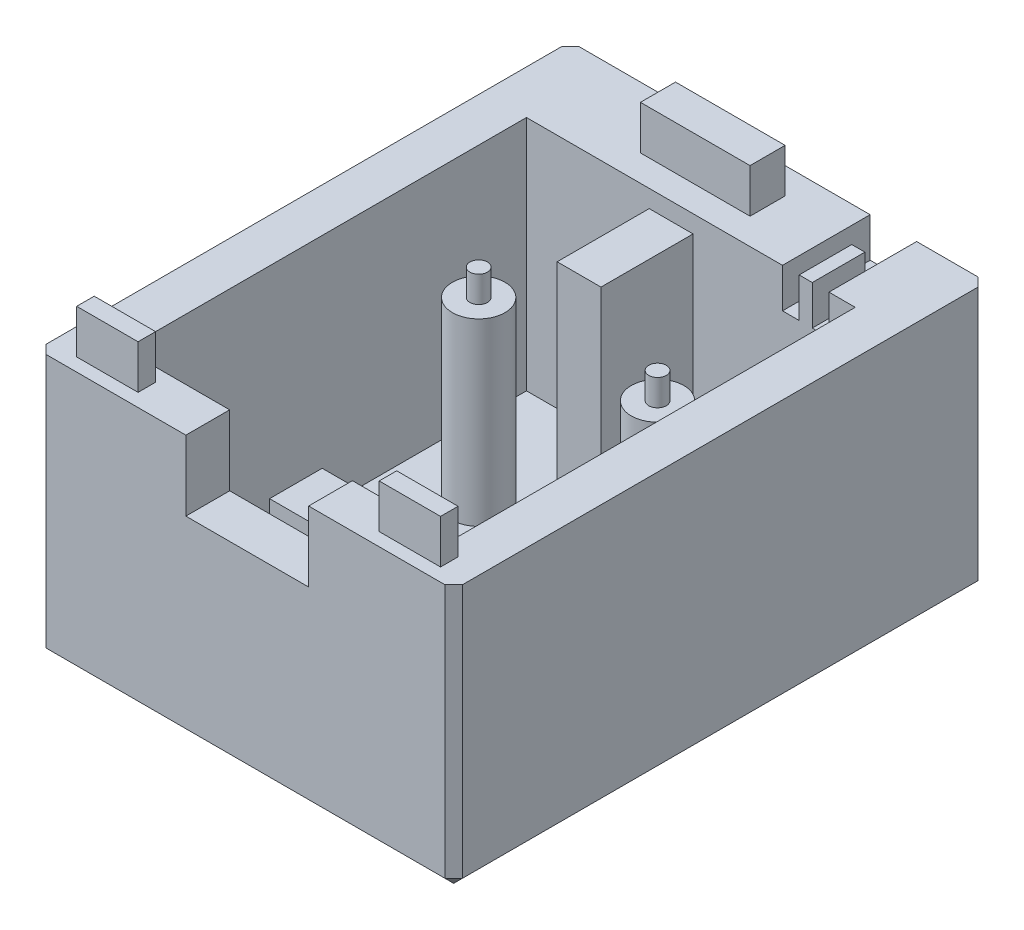
from build123d import *

# Parameters (mm, degrees)
SKETCH_1_W          = 47.5
SKETCH_1_H          = 60.8
EXTRUDE_1_DEPTH     = 30
SKETCH_3_W          = 37.5
SKETCH_3_H          = 45.8
CUT_EXTRUDE_1_DEPTH = 27
SKETCH_4_W          = 14
SKETCH_4_H          = 5
CUT_EXTRUDE_2_DEPTH = 8
SKETCH_5_R          = 3
SKETCH_5_W          = 6
SKETCH_5_H          = 6
EXTRUDE_4_DEPTH     = 20.5
SKETCH_6_W          = 5
SKETCH_6_H          = 10.5
EXTRUDE_6_DEPTH     = 25
SKETCH_7_R          = 1
EXTRUDE_7_DEPTH     = 3
SKETCH_12_W         = 5.3
SKETCH_12_H         = 4.5
CUT_EXTRUDE_5_DEPTH = 10
SKETCH_13_W         = 1.5
SKETCH_13_H         = 6
EXTRUDE_8_DEPTH     = 4.5
SKETCH_14_W         = 30
SKETCH_14_H         = 3
CUT_EXTRUDE_6_DEPTH = 3
CHAMFER_1_SIZE      = 1
SKETCH_16_W         = 12.5
SKETCH_16_H         = 4
SKETCH_16_W_2       = 7
SKETCH_16_H_2       = 2
EXTRUDE_9_DEPTH     = 5


with BuildPart() as part:
    # 草图1 → 凸台-拉伸1 (new body)
    with BuildSketch(Plane(origin=(0, 0, 0), x_dir=(1, 0, 0), z_dir=(0, 1, 0))):
        with Locations((-26.283333333, -1.583333333)):
            Rectangle(SKETCH_1_W, SKETCH_1_H)
    extrude(amount=EXTRUDE_1_DEPTH)

    # 草图3 → 切除-拉伸1 (cut)
    with BuildSketch(Plane(origin=(0, 30, 0), x_dir=(1, 0, 0), z_dir=(0, 1, 0))):
        with Locations((-26.283333333, -4.083333333)):
            Rectangle(SKETCH_3_W, SKETCH_3_H)
    extrude(amount=-CUT_EXTRUDE_1_DEPTH, mode=Mode.SUBTRACT)

    # 草图4 → 切除-拉伸2 (cut)
    with BuildSketch(Plane(origin=(0, 30, 0), x_dir=(1, 0, 0), z_dir=(0, 1, 0))):
        with Locations((-26.083333333, -29.483333333)):
            Rectangle(SKETCH_4_W, SKETCH_4_H)
    extrude(amount=-CUT_EXTRUDE_2_DEPTH, mode=Mode.SUBTRACT)

    # 草图5 → 凸台-拉伸4 (add)
    with BuildSketch(Plane(origin=(0, 3, 0), x_dir=(1, 0, 0), z_dir=(0, 1, 0))):
        with Locations(Location((-16.083333333, 4.816666667, 0), (0, 0, 270))):
            Circle(SKETCH_5_R)
        with Locations(Location((-36.483333333, 4.816666667, 0), (0, 0, 270))):
            Circle(SKETCH_5_R)
        with Locations((-25.533333333, -23.983333333)):
            Rectangle(SKETCH_5_W, SKETCH_5_H)
    extrude(amount=EXTRUDE_4_DEPTH)

    # 草图6 → 凸台-拉伸6 (add)
    with BuildSketch(Plane(origin=(0, 3, 0), x_dir=(1, 0, 0), z_dir=(0, 1, 0))):
        with Locations((-28.533333333, 13.566666667)):
            Rectangle(SKETCH_6_W, SKETCH_6_H)
    extrude(amount=EXTRUDE_6_DEPTH)

    # 草图7 → 凸台-拉伸7 (add)
    with BuildSketch(Plane(origin=(0, 23.5, 0), x_dir=(1, 0, 0), z_dir=(0, 1, 0))):
        with Locations(Location((-36.483333333, 4.816666667, 0), (0, 0, 270))):
            Circle(SKETCH_7_R)
        with Locations(Location((-16.083333333, 4.816666667, 0), (0, 0, 270))):
            Circle(SKETCH_7_R)
    extrude(amount=EXTRUDE_7_DEPTH)

    # 草图12 → 切除-拉伸5 (cut)
    with BuildSketch(Plane(origin=(0, 0, -28.816666667), x_dir=(-1, 0, 0), z_dir=(0, 0, -1))):
        with Locations((13.183333333, 27.75)):
            Rectangle(SKETCH_12_W, SKETCH_12_H)
    extrude(amount=-CUT_EXTRUDE_5_DEPTH, mode=Mode.SUBTRACT)

    # 草图13 → 凸台-拉伸8 (add)
    with BuildSketch(Plane(origin=(0, 25.5, 0), x_dir=(1, 0, 0), z_dir=(0, 1, 0))):
        with Locations((-13.183333333, 21.816666667)):
            Rectangle(SKETCH_13_W, SKETCH_13_H)
    extrude(amount=EXTRUDE_8_DEPTH)

    # 草图14 → 切除-拉伸6 (cut)
    with BuildSketch(Plane(origin=(0, 3, 0), x_dir=(1, 0, 0), z_dir=(0, 1, 0))):
        with Locations((-26.033333333, -2.090371048)):
            Rectangle(SKETCH_14_W, SKETCH_14_H)
        with Locations((-26.033333333, -8.090371048)):
            Rectangle(SKETCH_14_W, SKETCH_14_H)
        with Locations((-26.033333333, -14.090371048)):
            Rectangle(SKETCH_14_W, SKETCH_14_H)
    extrude(amount=-CUT_EXTRUDE_6_DEPTH, mode=Mode.SUBTRACT)

    # 倒角1
    chamfer_1_edges = [part.edges().sort_by_distance(p)[0] for p in [
        (-26.283333333, 0, -28.816666667),
        (-2.533333333, 0, 1.583333333),
        (-26.283333333, 0, 31.983333333),
        (-50.033333333, 0, 1.583333333),
        (-50.033333333, 15, -28.816666667),
        (-2.533333333, 15, -28.816666667),
        (-2.533333333, 15, 31.983333333),
        (-50.033333333, 15, 31.983333333),
    ]]
    chamfer(chamfer_1_edges, length=CHAMFER_1_SIZE)

    # 草图16 → 凸台-拉伸9 (add)
    with BuildSketch(Plane(origin=(0, 30, 0), x_dir=(1, 0, 0), z_dir=(0, 1, 0))):
        with Locations((-28.783333333, 23.816666667)):
            Rectangle(SKETCH_16_W, SKETCH_16_H)
        with Locations((-9.033333333, -29.483333333)):
            Rectangle(SKETCH_16_W_2, SKETCH_16_H_2)
        with Locations((-43.533333333, -29.483333333)):
            Rectangle(SKETCH_16_W_2, SKETCH_16_H_2)
    extrude(amount=EXTRUDE_9_DEPTH)


solid = part.part
